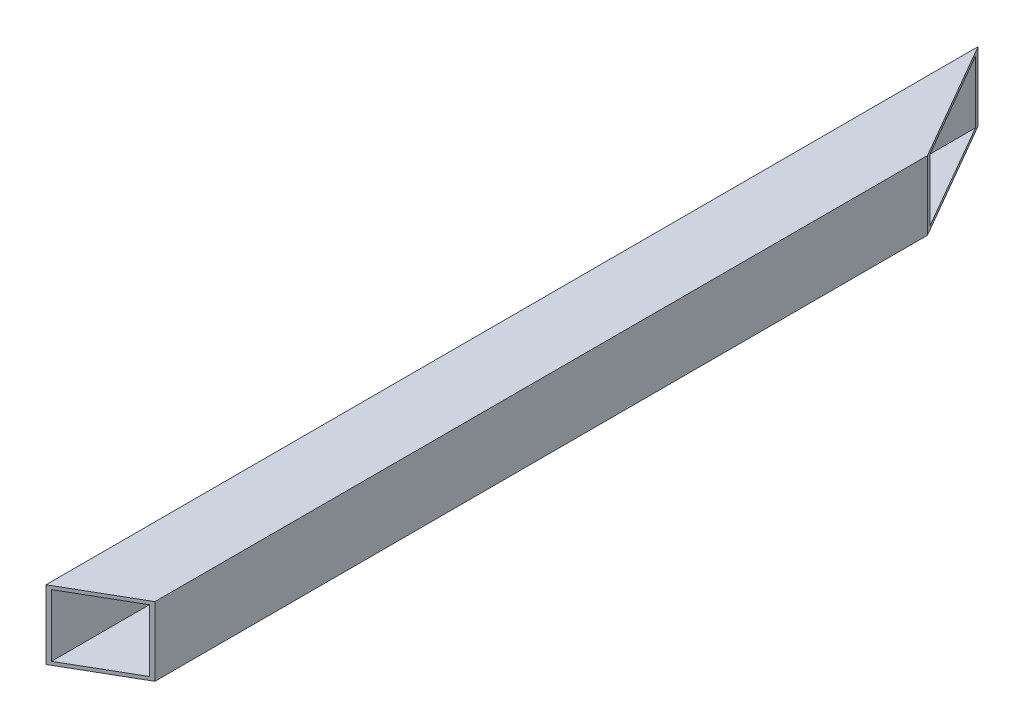
from build123d import *

# Parameters (mm, degrees)
SKETCH_1_W          = 20
SKETCH_1_H          = 20
SKETCH_1_W_2        = 18
SKETCH_1_H_2        = 18
EXTRUDE_1_DEPTH     = 270
CUT_EXTRUDE_1_DEPTH = 120


with BuildPart() as part:
    # 草图1 → 凸台-拉伸1 (new body)
    with BuildSketch(Plane.XY):
        with Locations((10, 10)):
            Rectangle(SKETCH_1_W, SKETCH_1_H)
        with Locations((10, 10)):
            Rectangle(SKETCH_1_W_2, SKETCH_1_H_2, mode=Mode.SUBTRACT)
    extrude(amount=EXTRUDE_1_DEPTH)

    # 草图2 → 切除-拉伸1 (cut)
    with BuildSketch(Plane(origin=(0, 20, 0), x_dir=(1, 0, 0), z_dir=(0, 1, 0))):
        Polygon((0, 0), (20, 0), (20, -34.641016151), align=None)
        Polygon((0, -270), (20, -258.452994616), (20, -270), align=None)
    extrude(amount=-CUT_EXTRUDE_1_DEPTH, mode=Mode.SUBTRACT)


solid = part.part
